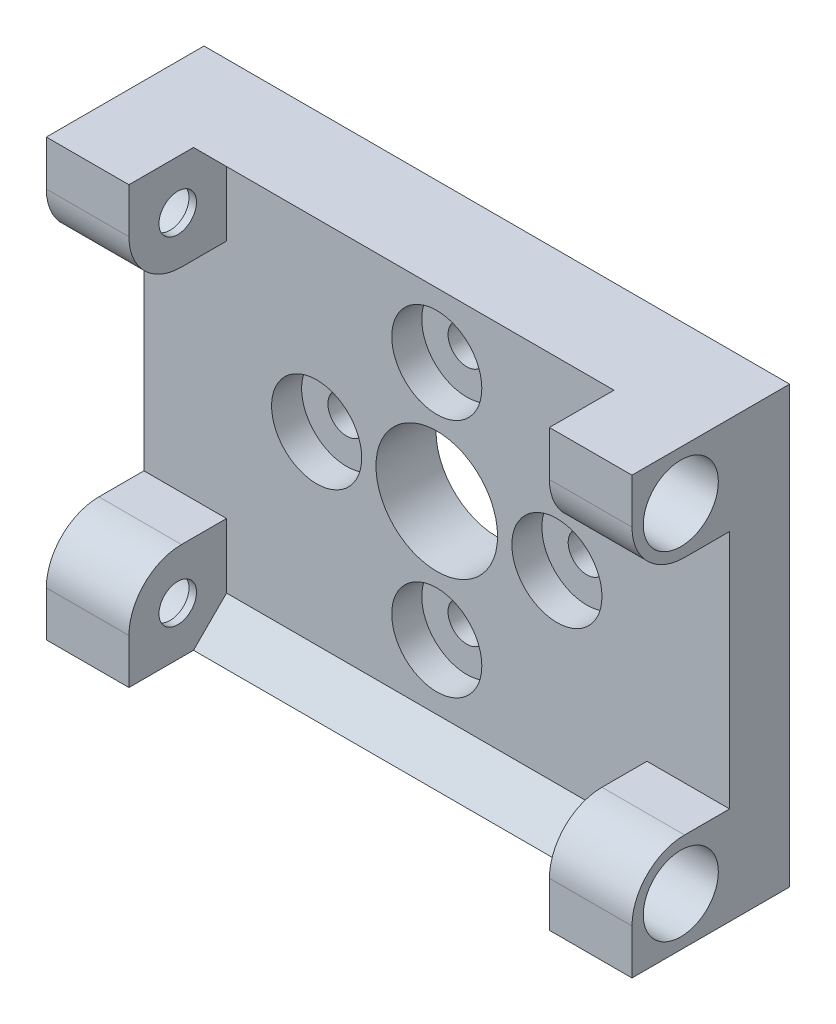
from build123d import *
from build123d.topology import SkipClean

# Parameters (mm, degrees)
SKETCH1_W           = 39
SKETCH1_H           = 23.712741858
BOSS_EXTRUDE1_DEPTH = 2
SKETCH9_R           = 4.05
CUT_EXTRUDE6_DEPTH  = 5
SKETCH10_R          = 1.25
BOSS_EXTRUDE5_DEPTH = 5.5
SKETCH11_R          = 2.5
CUT_EXTRUDE7_DEPTH  = 5
BOSS_EXTRUDE6_START = -5.5
SKETCH12_R          = 2.5
BOSS_EXTRUDE6_DEPTH = 5.5
BOSS_EXTRUDE7_DEPTH = 28
BOSS_EXTRUDE8_START = 2
SKETCH14_W          = 39
SKETCH14_H          = 29
SKETCH14_R          = 1.25
SKETCH14_R_2        = 4.05
BOSS_EXTRUDE8_DEPTH = 2
SKETCH15_R          = 3
CUT_EXTRUDE8_DEPTH  = 2


with BuildPart() as part:
    # Sketch1 → Boss-Extrude1 (new body)
    with BuildSketch(Plane.XY):
        with Locations((0, -11)):
            Rectangle(SKETCH1_W, SKETCH1_H)
        with BuildLine():
            ThreePointArc((1.25, -19), (0, -17.75), (-1.25, -19))
            ThreePointArc((-1.25, -19), (0, -20.25), (1.25, -19))
        make_face(mode=Mode.SUBTRACT)
        with BuildLine():
            ThreePointArc((-6.75, -11), (-8, -9.75), (-9.25, -11))
            ThreePointArc((-9.25, -11), (-8, -12.25), (-6.75, -11))
        make_face(mode=Mode.SUBTRACT)
        with BuildLine():
            ThreePointArc((1.25, -3), (0, -1.75), (-1.25, -3))
            ThreePointArc((-1.25, -3), (0, -4.25), (1.25, -3))
        make_face(mode=Mode.SUBTRACT)
        with BuildLine():
            ThreePointArc((9.25, -11), (8, -9.75), (6.75, -11))
            ThreePointArc((6.75, -11), (8, -12.25), (9.25, -11))
        make_face(mode=Mode.SUBTRACT)
    extrude(amount=BOSS_EXTRUDE1_DEPTH)

    # Sketch9 → Cut-Extrude6 (cut)
    with BuildSketch(Plane.XY.offset(2)):
        with Locations((0, -11)):
            Circle(SKETCH9_R)
    extrude(amount=-CUT_EXTRUDE6_DEPTH, mode=Mode.SUBTRACT)

    # Sketch10 → Boss-Extrude5 (add)
    # profile 1 of 2: a face of its own
    with BuildSketch(Plane.ZY.offset(19.5)):
        with BuildLine():
            Line((4.2, 3.5), (8.5, 3.5))
            Line((8.5, 3.5), (8.5, 0.5))
            ThreePointArc((8.5, 0.5), (7.474873734, -1.974873734), (5, -3))
            Line((5, -3), (2, -3))
            Line((2, -3), (2, 0.856370929))
            Line((2, 0.856370929), (0, 0.856370929))
            Line((0, 0.856370929), (0, 3.5))
            Line((0, 3.5), (4.2, 3.5))
        make_face()
        with Locations((5.25, 0.25)):
            Circle(SKETCH10_R, mode=Mode.SUBTRACT)
    # profile 2 of 2: a face of its own
    with BuildSketch(Plane.ZY.offset(19.5)):
        with BuildLine():
            Line((5, -19), (2, -19))
            Line((2, -19), (2, -22.856370929))
            Line((2, -22.856370929), (0, -22.856370929))
            Line((0, -22.856370929), (0, -25.5))
            Line((0, -25.5), (4.2, -25.5))
            Line((4.2, -25.5), (8.5, -25.5))
            Line((8.5, -25.5), (8.5, -22.5))
            ThreePointArc((8.5, -22.5), (7.474873734, -20.025126266), (5, -19))
        make_face()
        with Locations((5.25, -22.25)):
            Circle(SKETCH10_R, mode=Mode.SUBTRACT)
    extrude(amount=-BOSS_EXTRUDE5_DEPTH)

    # Sketch11 → Cut-Extrude7 (cut)
    with BuildSketch(Plane.ZY.offset(19.5)):
        with Locations((5.25, 0.25)):
            Circle(SKETCH11_R)
        with Locations(Location((5.25, -22.25, 0), (0, 0, 180))):
            Circle(SKETCH11_R)
    extrude(amount=-CUT_EXTRUDE7_DEPTH, mode=Mode.SUBTRACT)

    # Sketch12 → Boss-Extrude6 (add)
    with BuildSketch(Plane(origin=(19.5, 0, 0), x_dir=(0, 0, -1), z_dir=(1, 0, 0)).offset(BOSS_EXTRUDE6_START)):
        with BuildLine():
            ThreePointArc((-8.5, 0.5), (-7.474873734, -1.974873734), (-5, -3))
            Line((-5, -3), (-2, -3))
            Line((-2, -3), (-2, -19))
            Line((-2, -19), (-5, -19))
            ThreePointArc((-5, -19), (-7.474873734, -20.025126266), (-8.5, -22.5))
            Line((-8.5, -22.5), (-8.5, -25.5))
            Line((-8.5, -25.5), (0, -25.5))
            Line((0, -25.5), (0, 3.5))
            Line((0, 3.5), (-8.5, 3.5))
            Line((-8.5, 3.5), (-8.5, 0.5))
        make_face()
        with Locations((-5.25, -22.25)):
            Circle(SKETCH12_R, mode=Mode.SUBTRACT)
        with Locations(Location((-5.25, 0.25, 0), (0, 0, 180))):
            Circle(SKETCH12_R, mode=Mode.SUBTRACT)
    extrude(amount=BOSS_EXTRUDE6_DEPTH)

    # Sketch13 → Boss-Extrude7 (add)
    with BuildSketch(Plane.ZY.offset(-14)):
        Polygon((0, 3.5), (4.2, 3.5), (2, 1.3), (2, 0.856370929), (0, 0.856370929), align=None)
        Polygon((2, -22.856370929), (0, -22.856370929), (0, -25.5), (4.2, -25.5), (2, -23.3), align=None)
    extrude(amount=BOSS_EXTRUDE7_DEPTH)

    # Sketch14 → Boss-Extrude8 (add)
    with SkipClean():  # the faces are left unmerged after this step: merging them gives an invalid solid
        with BuildSketch(Plane(origin=(0, 0, 0), x_dir=(-1, 0, 0), z_dir=(0, 0, -1)).offset(BOSS_EXTRUDE8_START)):
            with Locations((0, -11)):
                Rectangle(SKETCH14_W, SKETCH14_H)
            with Locations((0, -19)):
                Circle(SKETCH14_R, mode=Mode.SUBTRACT)
            with Locations((8, -11)):
                Circle(SKETCH14_R, mode=Mode.SUBTRACT)
            with Locations((0, -3)):
                Circle(SKETCH14_R, mode=Mode.SUBTRACT)
            with Locations(Location((0, -11, 0), (0, 0, 180))):
                Circle(SKETCH14_R_2, mode=Mode.SUBTRACT)
            with Locations((-8, -11)):
                Circle(SKETCH14_R, mode=Mode.SUBTRACT)
        extrude(amount=-BOSS_EXTRUDE8_DEPTH)

    # Sketch15 → Cut-Extrude8 (cut)
    with BuildSketch(Plane.XY.offset(2)):
        with Locations((0, -3)):
            Circle(SKETCH15_R)
        with Locations((8, -11)):
            Circle(SKETCH15_R)
        with Locations((0, -19)):
            Circle(SKETCH15_R)
        with Locations((-8, -11)):
            Circle(SKETCH15_R)
    extrude(amount=-CUT_EXTRUDE8_DEPTH, mode=Mode.SUBTRACT)


solid = part.part
